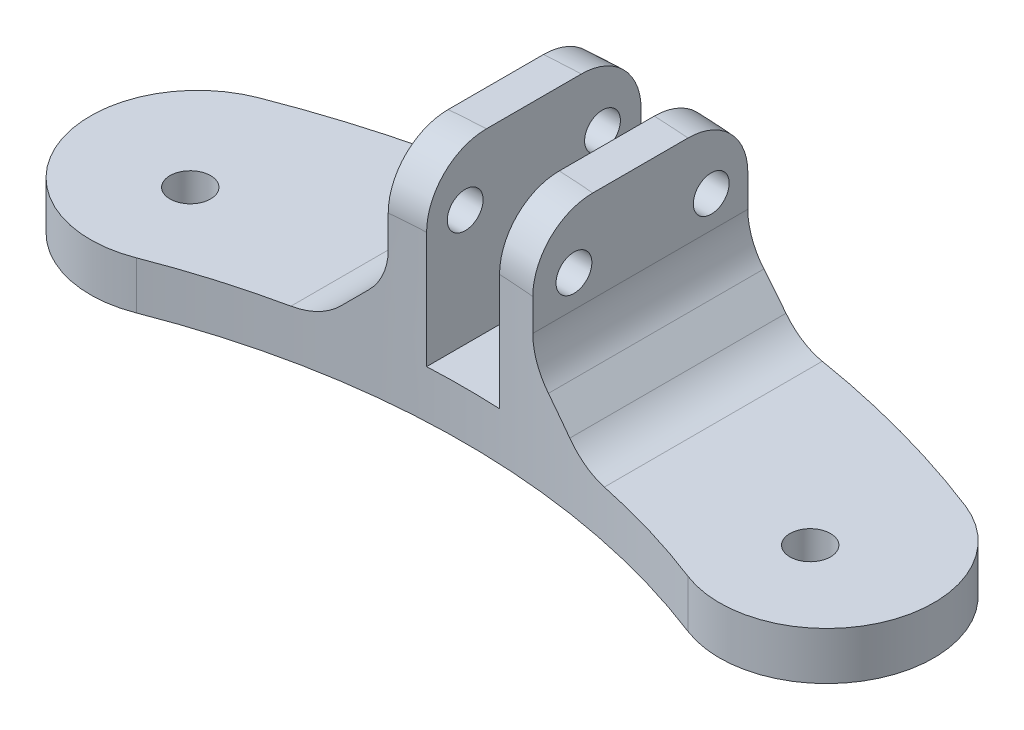
from build123d import *

# Parameters (mm, degrees)
SKETCH1_R               = 1.7
BOSS_EXTRUDE1_DEPTH     = 18.75
SKETCH2_W               = 29.270887873
SKETCH2_H               = 14.75
SKETCH2_W_2             = 6.11
CUT_EXTRUDE1_DEPTH      = 91.963568829
CHAMFER1_SIZE           = 5
FILLET1_R               = 5
CUT_EXTRUDE2_DEPTH      = 93.192977357
CUT_EXTRUDE2_DEPTH_BACK = 93.192977357
SKETCH4_R               = 1.5
FILLET2_R               = 5


with BuildPart() as part:
    # Sketch1 → Boss-Extrude1 (new body)
    with BuildSketch(Plane(origin=(0, 0, 0), x_dir=(1, 0, 0), z_dir=(0, 1, 0))):
        with BuildLine():
            ThreePointArc((-23.098921993, 59.418030115), (0, 63.75), (23.098921993, 59.418030115))
            ThreePointArc((23.098921993, 59.418030115), (34.716014466, 64.531190827), (29.602853754, 76.148283301))
            ThreePointArc((29.602853754, 76.148283301), (0, 81.7), (-29.602853754, 76.148283301))
            ThreePointArc((-29.602853754, 76.148283301), (-34.716014466, 64.531190827), (-23.098921993, 59.418030115))
        make_face()
        with Locations(Location((-25.965, 66.790526087, 0), (0, 0, 270))):
            Circle(SKETCH1_R, mode=Mode.SUBTRACT)
        with Locations(Location((25.965, 66.790526087, 0), (0, 0, 270))):
            Circle(SKETCH1_R, mode=Mode.SUBTRACT)
    extrude(amount=BOSS_EXTRUDE1_DEPTH)

    # Sketch2 → Cut-Extrude1 (cut, through all)
    with BuildSketch(Plane.XY):
        with Locations((-20.690443936, 11.375)):
            Rectangle(SKETCH2_W, SKETCH2_H)
        with Locations((20.690443936, 11.375)):
            Rectangle(SKETCH2_W, SKETCH2_H)
        with Locations((0, 11.375)):
            Rectangle(SKETCH2_W_2, SKETCH2_H)
    extrude(amount=-CUT_EXTRUDE1_DEPTH, mode=Mode.SUBTRACT)

    # Chamfer1
    chamfer1_edges = [part.edges().sort_by_distance(p)[0] for p in [
        (-6.055, 4, -72.468555262),
        (6.055, 4, -72.468555262),
    ]]
    chamfer(chamfer1_edges, length=CHAMFER1_SIZE)

    # Fillet1
    fillet1_edges = [part.edges().sort_by_distance(p)[0] for p in [
        (11.055, 4, -71.866378435),
        (6.055, 9, -72.468555262),
        (-11.055, 4, -71.866378435),
        (-6.055, 9, -72.468555262),
    ]]
    fillet(fillet1_edges, radius=FILLET1_R)

    # Sketch4 → Cut-Extrude2 (cut, two sides: drawn at the far end of the back side and taken through both)
    with BuildSketch(Plane.ZY.offset(-3.055).offset(-CUT_EXTRUDE2_DEPTH_BACK)):
        with Locations(Location((-78.409810047, 13.75, 0), (0, 0, 270))):
            Circle(SKETCH4_R)
        with Locations(Location((-66.909810047, 13.75, 0), (0, 0, 270))):
            Circle(SKETCH4_R)
    extrude(amount=CUT_EXTRUDE2_DEPTH + CUT_EXTRUDE2_DEPTH_BACK, mode=Mode.SUBTRACT)

    # Fillet2
    fillet2_edges = [part.edges().sort_by_distance(p)[0] for p in [
        (4.555770299, 18.75, -81.57288126),
        (-4.555770299, 18.75, -81.57288126),
        (-4.556267903, 18.75, -63.586971329),
        (4.556267903, 18.75, -63.586971329),
    ]]
    fillet(fillet2_edges, radius=FILLET2_R)


solid = part.part
